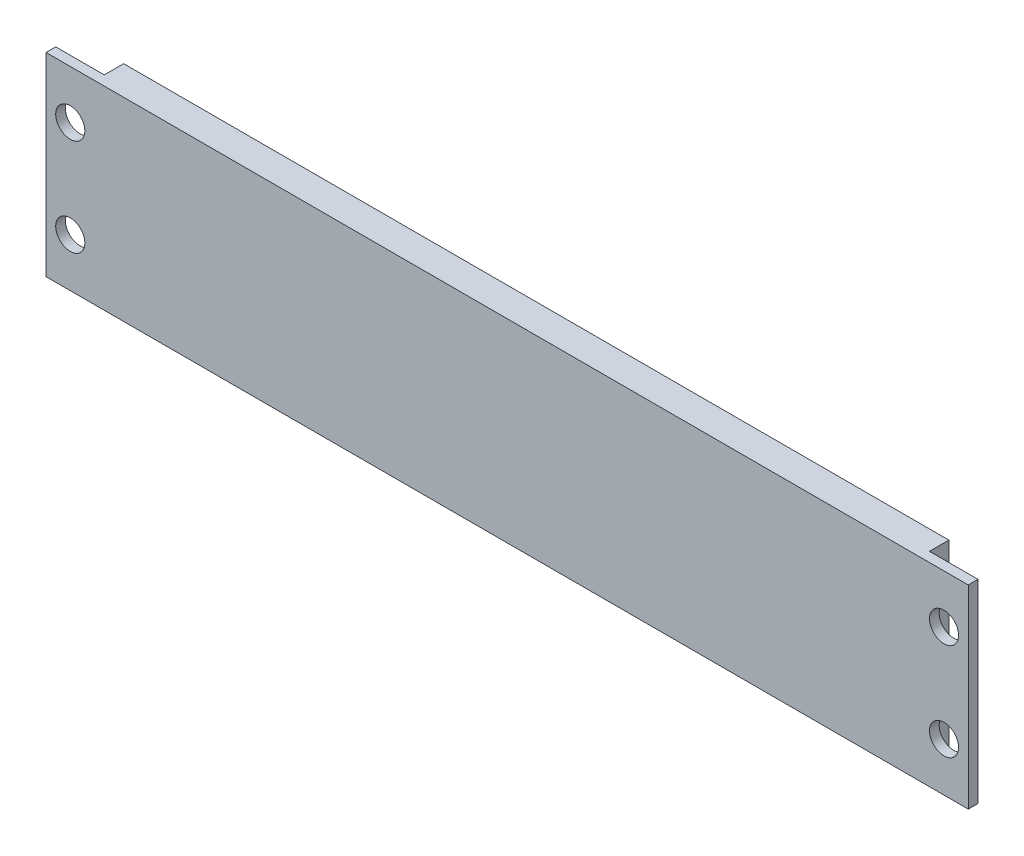
from build123d import *

# Parameters (mm, degrees)
SKETCH_1_W      = 85
SKETCH_1_H      = 20
EXTRUDE_1_DEPTH = 3
SKETCH_2_W      = 5
SKETCH_2_H      = 20
SKETCH_2_R      = 1.5
EXTRUDE_2_DEPTH = 1


with BuildPart() as part:
    # Эскиз1 → Выдавливание1 (new body)
    with BuildSketch(Plane.XY):
        with Locations((42.5, 10)):
            Rectangle(SKETCH_1_W, SKETCH_1_H)
    extrude(amount=EXTRUDE_1_DEPTH)

    # Эскиз2 → Выдавливание2 (add)
    # profile 1 of 2: a face of its own
    with BuildSketch(Plane.XY.offset(3)):
        with Locations((87.5, 10)):
            Rectangle(SKETCH_2_W, SKETCH_2_H)
        with Locations((87.5, 15)):
            Circle(SKETCH_2_R, mode=Mode.SUBTRACT)
        with Locations((87.5, 5)):
            Circle(SKETCH_2_R, mode=Mode.SUBTRACT)
    # profile 2 of 2: a face of its own
    with BuildSketch(Plane.XY.offset(3)):
        with Locations((-2.5, 10)):
            Rectangle(SKETCH_2_W, SKETCH_2_H)
        with Locations((-2.5, 15)):
            Circle(SKETCH_2_R, mode=Mode.SUBTRACT)
        with Locations((-2.5, 5)):
            Circle(SKETCH_2_R, mode=Mode.SUBTRACT)
    extrude(amount=-EXTRUDE_2_DEPTH)


solid = part.part
